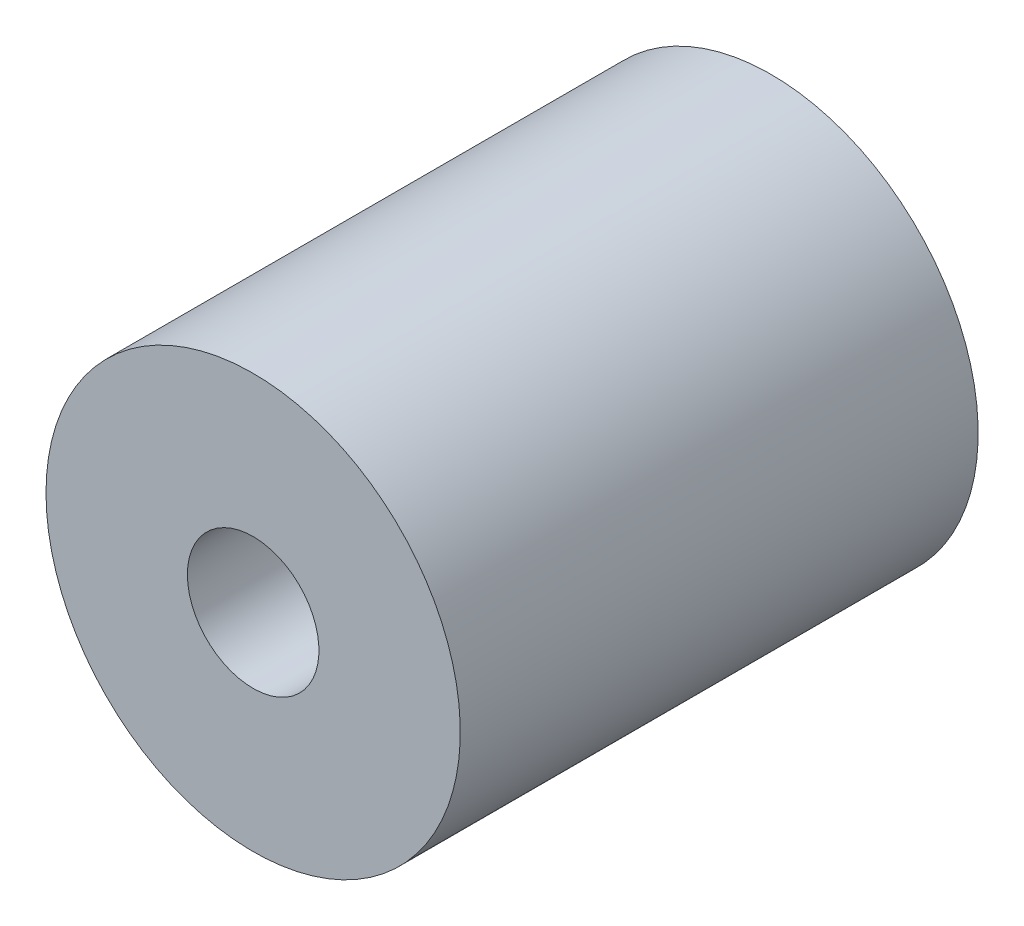
from build123d import *

# Parameters (mm, degrees)
SKETCH1_R           = 10
BOSS_EXTRUDE1_DEPTH = 25
SKETCH2_R           = 3.175
CUT_EXTRUDE1_DEPTH  = 12.5
SKETCH3_R           = 2.5
CUT_EXTRUDE2_DEPTH  = 29.722813233


with BuildPart() as part:
    # Sketch1 → Boss-Extrude1 (new body)
    with BuildSketch(Plane.XY.offset(25)):
        Circle(SKETCH1_R)
    extrude(amount=-BOSS_EXTRUDE1_DEPTH)

    # Sketch2 → Cut-Extrude1 (cut)
    with BuildSketch(Plane.XY.offset(25)):
        Circle(SKETCH2_R)
    extrude(amount=-CUT_EXTRUDE1_DEPTH, mode=Mode.SUBTRACT)

    # Sketch3 → Cut-Extrude2 (cut, through all)
    with BuildSketch(Plane(origin=(0, 0, 0), x_dir=(-1, 0, 0), z_dir=(0, 0, -1))):
        Circle(SKETCH3_R)
    extrude(amount=-CUT_EXTRUDE2_DEPTH, mode=Mode.SUBTRACT)


solid = part.part
